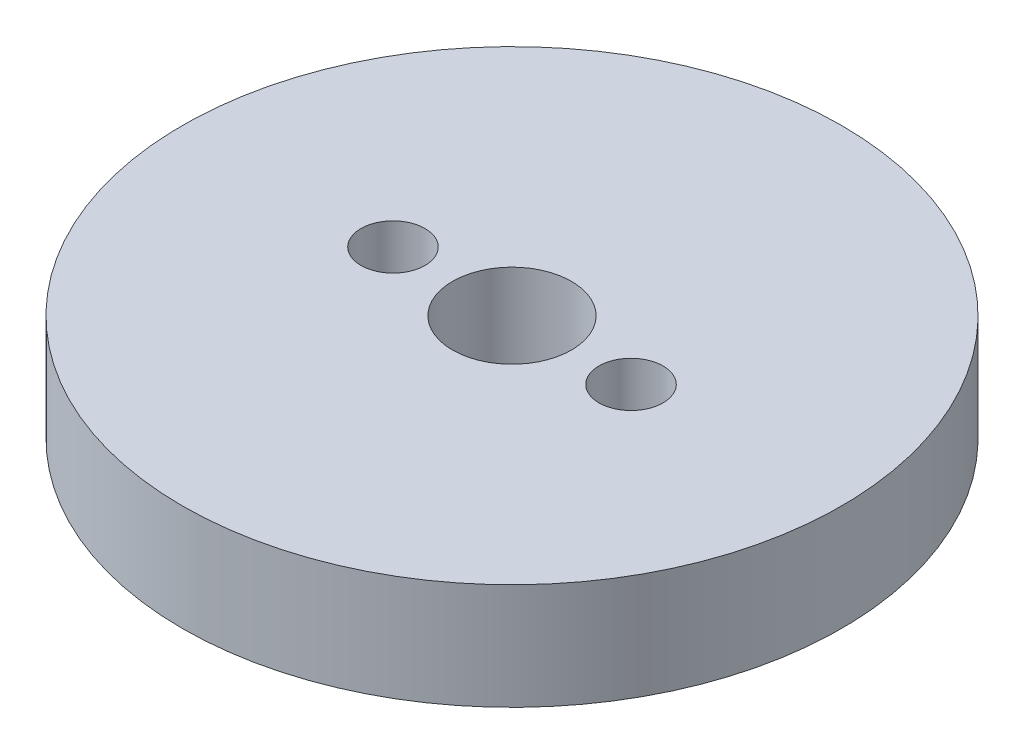
from build123d import *

# Parameters (mm, degrees)
SKETCH_1_R      = 18
SKETCH_1_R_2    = 3.25
SKETCH_1_R_3    = 1.75
EXTRUDE_1_DEPTH = 5.8


with BuildPart() as part:
    # ｽｹｯﾁ1 → ﾎﾞｽ - 押し出し1 (new body)
    with BuildSketch(Plane(origin=(0, 0, 0), x_dir=(1, 0, 0), z_dir=(0, 1, 0))):
        with Locations(Location((0, 0, 0), (0, 0, 270))):
            Circle(SKETCH_1_R)
        with Locations(Location((0, 0, 0), (0, 0, 270))):
            Circle(SKETCH_1_R_2, mode=Mode.SUBTRACT)
        with Locations(Location((6.5, 0, 0), (0, 0, 270))):
            Circle(SKETCH_1_R_3, mode=Mode.SUBTRACT)
        with Locations(Location((-6.5, 0, 0), (0, 0, 90))):
            Circle(SKETCH_1_R_3, mode=Mode.SUBTRACT)
    extrude(amount=EXTRUDE_1_DEPTH)


solid = part.part
